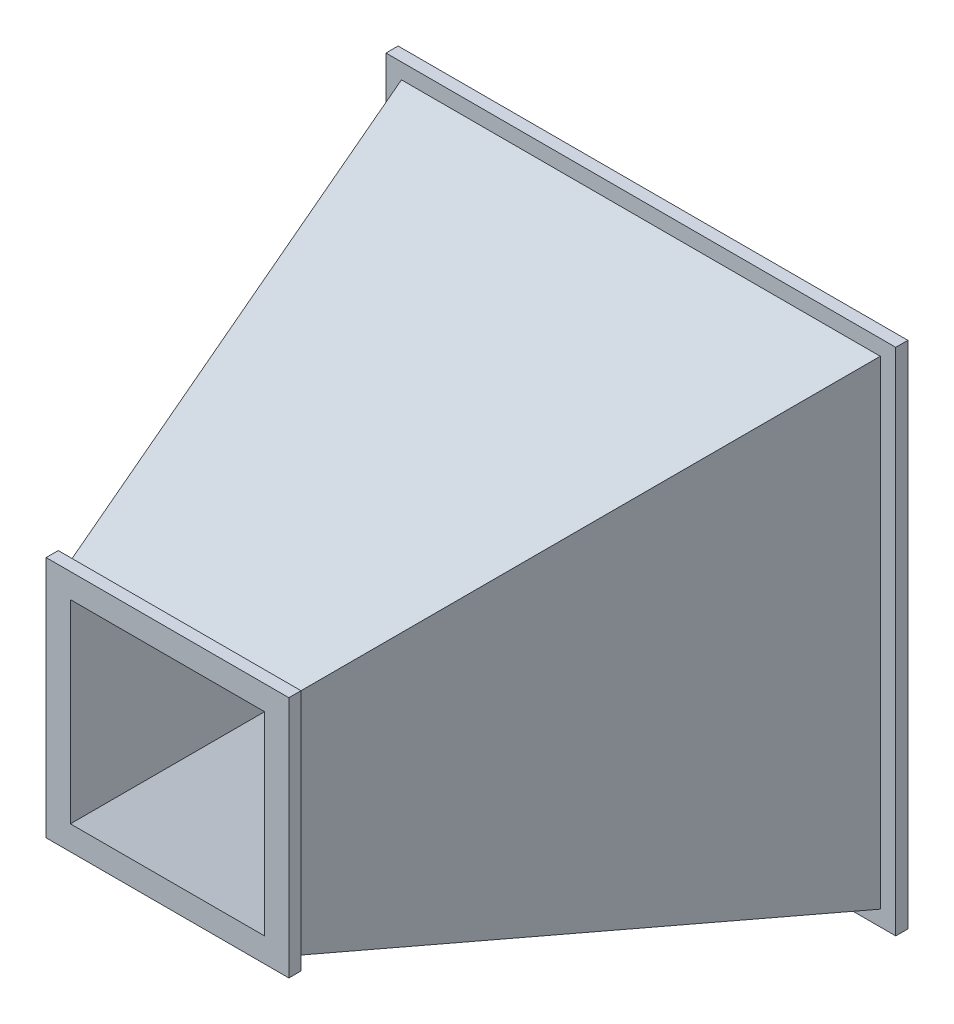
from build123d import *

# Parameters (mm, degrees)
SKETCH8_W           = 210
SKETCH8_H           = 210
BOSS_EXTRUDE1_DEPTH = 5
SKETCH7_W           = 100
SKETCH7_H           = 100
BOSS_EXTRUDE2_DEPTH = 5


with BuildPart() as part:
    # Sketch2 → Loft1 section 0
    with BuildSketch(Plane.XY.offset(200)):
        with BuildLine():
            Line((-45, 45), (45, 45))
            Line((45, 45), (45, -45))
            Line((45, -45), (-45, -45))
            Line((-45, -45), (-45, 45))
        make_face()
    # Sketch1 → Loft1 section 1
    with BuildSketch(Plane.XY):
        with BuildLine():
            Line((-100, 100), (100, 100))
            Line((100, 100), (100, -100))
            Line((100, -100), (-100, -100))
            Line((-100, -100), (-100, 100))
        make_face()
    loft()

    # Sketch8 → Boss-Extrude1 (add)
    with BuildSketch(Plane(origin=(0, 0, 0), x_dir=(-1, 0, 0), z_dir=(0, 0, -1))):
        Rectangle(SKETCH8_W, SKETCH8_H)
    extrude(amount=-BOSS_EXTRUDE1_DEPTH)

    # Sketch7 → Boss-Extrude2 (add)
    with BuildSketch(Plane.XY.offset(200)):
        Rectangle(SKETCH7_W, SKETCH7_H)
    extrude(amount=-BOSS_EXTRUDE2_DEPTH)

    # Sketch5 → Cut-Loft2 section 0
    with BuildSketch(Plane.XY.offset(200)):
        with BuildLine():
            Line((40, -40), (40, 40))
            Line((40, 40), (-40, 40))
            Line((-40, 40), (-40, -40))
            Line((-40, -40), (40, -40))
        make_face()
    # Sketch6 → Cut-Loft2 section 1
    with BuildSketch(Plane(origin=(0, 0, 0), x_dir=(-1, 0, 0), z_dir=(0, 0, -1))):
        with BuildLine():
            Line((-95, 95), (-95, -95))
            Line((-95, -95), (95, -95))
            Line((95, -95), (95, 95))
            Line((95, 95), (-95, 95))
        make_face()
    loft(mode=Mode.SUBTRACT)


solid = part.part
